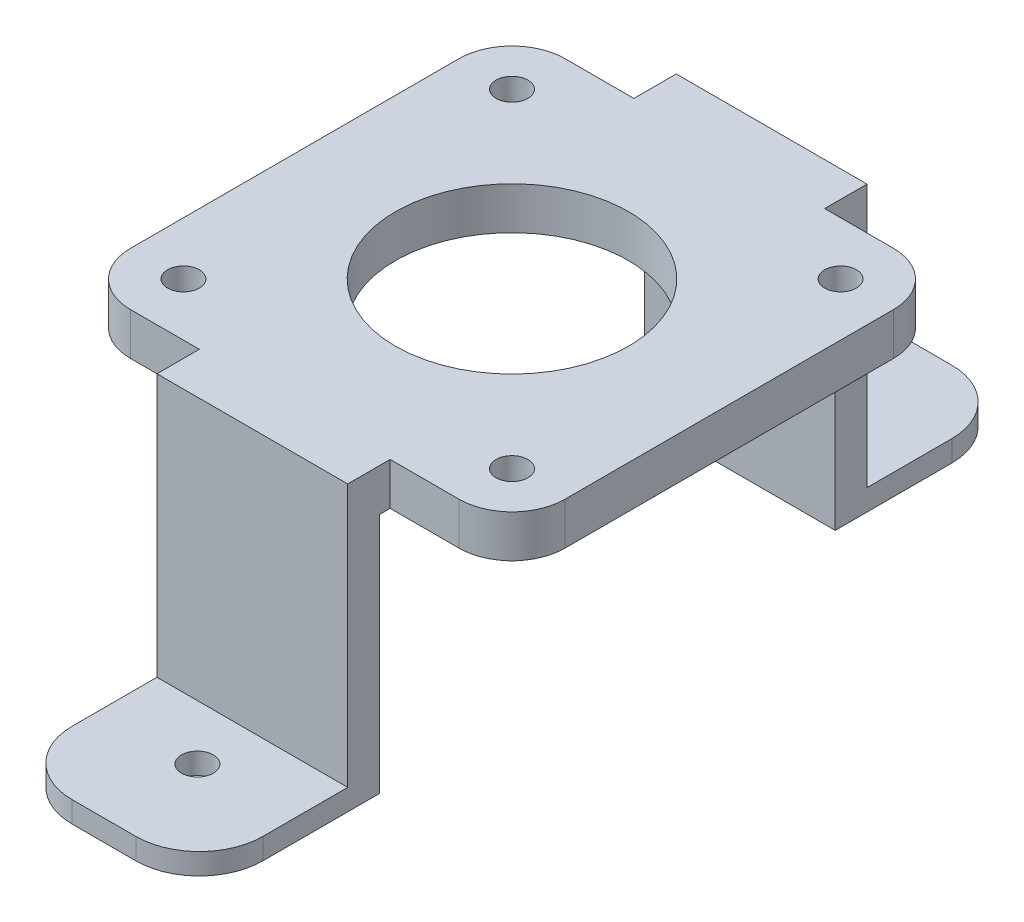
from build123d import *

# Parameters (mm, degrees)
SKETCH_2_R             = 11
SKETCH_2_R_2           = 1.5
EXTRUDE_483_DEPTH      = 4
SKETCH_3_W             = 18
SKETCH_3_H             = 26.8
EXTRUDE_726_DEPTH      = 4
EXTRUDE_922_DEPTH      = 2
SKETCH_5_R             = 1.5
CUT_EXTRUDE_1097_DEPTH = 51.175093423
SKETCH_7_W             = 18
SKETCH_7_H             = 22.8
CUT_EXTRUDE_1_DEPTH    = 1


with BuildPart() as part:
    # Эскиз2 → Extrude 483 (new body)
    with BuildSketch(Plane(origin=(0, 0, 0), x_dir=(1, 0, 0), z_dir=(0, 1, 0))):
        with BuildLine():
            Line((-15.5, -20.5), (15.5, -20.5))
            ThreePointArc((15.5, -20.5), (19.035533906, -19.035533906), (20.5, -15.5))
            Line((20.5, -15.5), (20.5, 15.5))
            ThreePointArc((20.5, 15.5), (19.035533906, 19.035533906), (15.5, 20.5))
            Line((15.5, 20.5), (-15.5, 20.5))
            ThreePointArc((-15.5, 20.5), (-19.035533906, 19.035533906), (-20.5, 15.5))
            Line((-20.5, 15.5), (-20.5, -15.5))
            ThreePointArc((-20.5, -15.5), (-19.035533906, -19.035533906), (-15.5, -20.5))
        make_face()
        with Locations(Location((0, 0, 0), (0, 0, 270))):
            Circle(SKETCH_2_R, mode=Mode.SUBTRACT)
        with Locations(Location((-15.5, 15.5, 0), (0, 0, 270))):
            Circle(SKETCH_2_R_2, mode=Mode.SUBTRACT)
        with Locations(Location((15.5, -15.5, 0), (0, 0, 90))):
            Circle(SKETCH_2_R_2, mode=Mode.SUBTRACT)
        with Locations(Location((-15.5, -15.5, 0), (0, 0, 90))):
            Circle(SKETCH_2_R_2, mode=Mode.SUBTRACT)
        with Locations(Location((15.5, 15.5, 0), (0, 0, 270))):
            Circle(SKETCH_2_R_2, mode=Mode.SUBTRACT)
    extrude(amount=EXTRUDE_483_DEPTH)

    # Эскиз3 → Extrude 726 (add)
    with BuildSketch(Plane.XY.offset(20.5)):
        with Locations((0, -9.4)):
            Rectangle(SKETCH_3_W, SKETCH_3_H)
    extrude_726 = extrude(amount=EXTRUDE_726_DEPTH)

    # Эскиз4 → Extrude 922 (add)
    with BuildSketch(Plane.XZ.offset(22.8)):
        with BuildLine():
            Line((9, 24.5), (-9, 24.5))
            Line((-9, 24.5), (-9, 32.5))
            ThreePointArc((-9, 32.5), (-7.242640687, 36.742640687), (-3, 38.5))
            Line((-3, 38.5), (3, 38.5))
            ThreePointArc((3, 38.5), (7.242640687, 36.742640687), (9, 32.5))
            Line((9, 32.5), (9, 24.5))
        make_face()
    extrude_922 = extrude(amount=-EXTRUDE_922_DEPTH)

    # Эскиз5 → Cut-Extrude 1097 (cut, through all)
    with BuildSketch(Plane(origin=(0, -20.8, 0), x_dir=(1, 0, 0), z_dir=(0, 1, 0))):
        with Locations(Location((0, -29.678729535, 0), (0, 0, 270))):
            Circle(SKETCH_5_R)
    cut_extrude_1097 = extrude(amount=-CUT_EXTRUDE_1097_DEPTH, mode=Mode.SUBTRACT)

    # Эскиз7 → Вырез-Вытянуть1 (cut)
    with BuildSketch(Plane(origin=(0, 0, 20.5), x_dir=(-1, 0, 0), z_dir=(0, 0, -1))):
        with Locations((0, -11.4)):
            Rectangle(SKETCH_7_W, SKETCH_7_H)
    cut_extrude_1 = extrude(amount=-CUT_EXTRUDE_1_DEPTH, mode=Mode.SUBTRACT)

    # Зеркальное отражение1: Extrude 726, Extrude 922, Cut-Extrude 1097, Вырез-Вытянуть1 across plane
    add(extrude_726.mirror(Plane.XY))
    add(extrude_922.mirror(Plane.XY))
    add(cut_extrude_1097.mirror(Plane.XY), mode=Mode.SUBTRACT)
    add(cut_extrude_1.mirror(Plane.XY), mode=Mode.SUBTRACT)


solid = part.part
